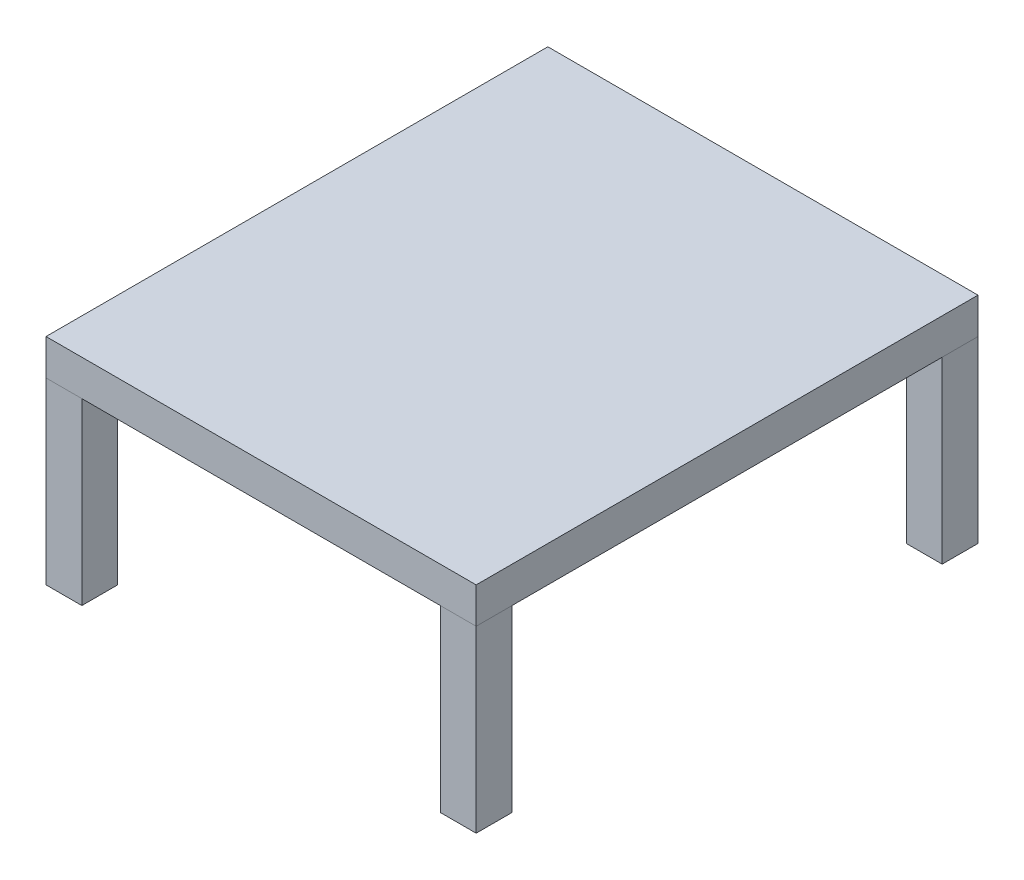
from build123d import *

# Parameters (mm, degrees)
SKETCH1_W             = 50.8
SKETCH1_H             = 50.8
BOSS_EXTRUDE1_DEPTH   = 254
BOSS_EXTRUDE1_2_DEPTH = 254
SKETCH2_W             = 609.6
SKETCH2_H             = 711.2
BOSS_EXTRUDE2_DEPTH   = 50.8


with BuildPart() as part:
    # Sketch1 → Boss-Extrude1 (new body)
    with BuildSketch(Plane(origin=(0, 0, 0), x_dir=(1, 0, 0), z_dir=(0, 1, 0))):
        with Locations((-279.4, 330.2)):
            Rectangle(SKETCH1_W, SKETCH1_H)
    extrude(amount=BOSS_EXTRUDE1_DEPTH)


with BuildPart() as body_2:
    # Sketch1 → Boss-Extrude1 2 (new body)
    with BuildSketch(Plane(origin=(0, 0, 0), x_dir=(1, 0, 0), z_dir=(0, 1, 0))):
        with Locations((-279.4, -330.2)):
            Rectangle(SKETCH1_W, SKETCH1_H)
    extrude(amount=BOSS_EXTRUDE1_2_DEPTH)


with BuildPart() as body_3:
    # Mirror2: mirrored copy
    add(part.part.mirror(Plane(origin=(0, 0, 0), x_dir=(0, 0, 1), z_dir=(1, 0, 0))))


with BuildPart() as body_4:
    # Mirror2 2: mirrored copy
    add(body_2.part.mirror(Plane(origin=(0, 0, 0), x_dir=(0, 0, 1), z_dir=(1, 0, 0))))


with BuildPart() as body_5:
    # Sketch2 → Boss-Extrude2 (new body)
    with BuildSketch(Plane(origin=(0, 254, 0), x_dir=(1, 0, 0), z_dir=(0, 1, 0))):
        Rectangle(SKETCH2_W, SKETCH2_H)
    extrude(amount=BOSS_EXTRUDE2_DEPTH)


solid = Compound([part.part, body_2.part, body_3.part, body_4.part, body_5.part])
